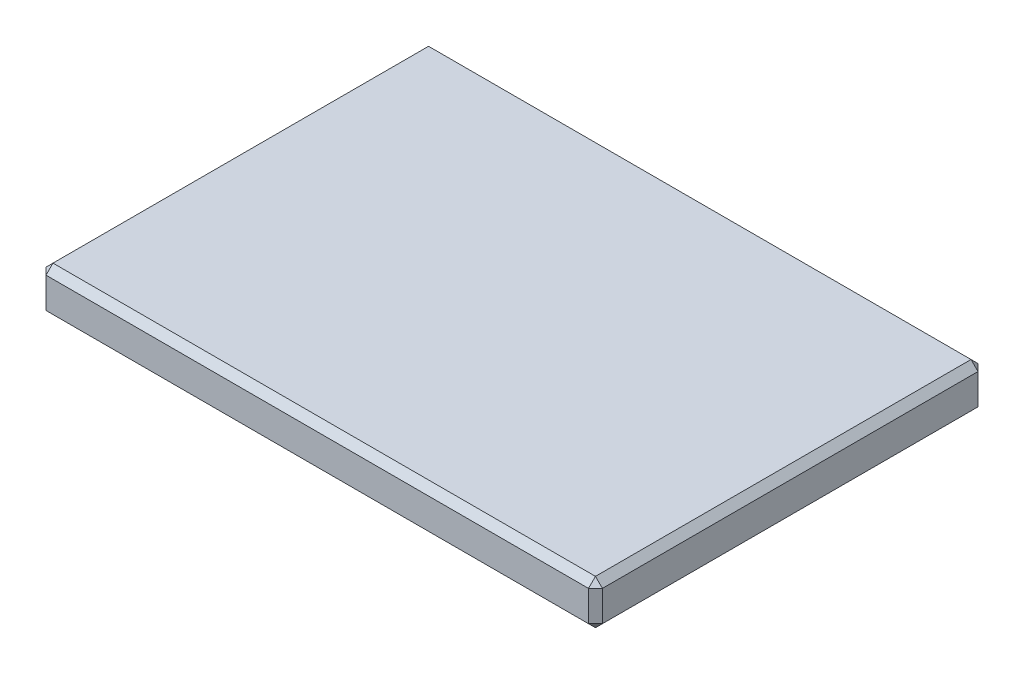
from build123d import *

# Parameters (mm, degrees)
SKETCH1_W           = 40
SKETCH1_H           = 28
BOSS_EXTRUDE1_DEPTH = 3.2
CHAMFER1_SIZE       = 0.5


with BuildPart() as part:
    # Sketch1 → Boss-Extrude1 (new body)
    with BuildSketch(Plane(origin=(0, 0, 0), x_dir=(1, 0, 0), z_dir=(0, 1, 0))):
        with Locations((20, 14)):
            Rectangle(SKETCH1_W, SKETCH1_H)
    extrude(amount=BOSS_EXTRUDE1_DEPTH)

    # Chamfer1
    chamfer1_edges = [part.edges().sort_by_distance(p)[0] for p in [
        (40, 3.2, -14),
        (20, 3.2, -28),
        (0, 3.2, -14),
        (20, 0, -28),
        (40, 0, -14),
        (20, 0, 0),
        (0, 0, -14),
        (20, 3.2, 0),
        (0, 1.6, -28),
        (40, 1.6, -28),
        (40, 1.6, 0),
        (0, 1.6, 0),
    ]]
    chamfer(chamfer1_edges, length=CHAMFER1_SIZE)


solid = part.part
